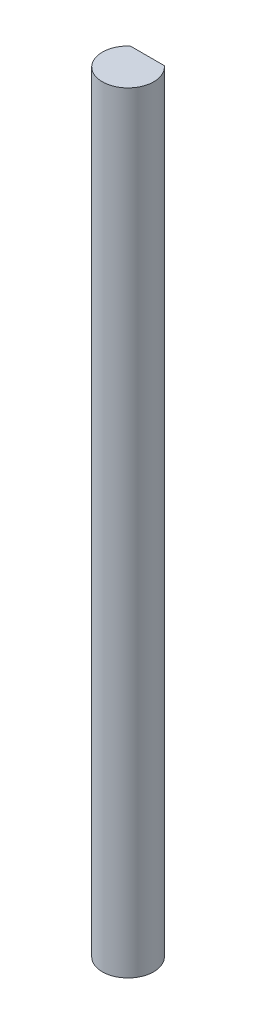
from build123d import *

# Parameters (mm, degrees)
SKETCH1_R          = 2
LENGTH_DEPTH       = 60
CUT_EXTRUDE1_DEPTH = 12


with BuildPart() as part:
    # Sketch1 → Length (new body)
    with BuildSketch(Plane(origin=(0, 0, 0), x_dir=(1, 0, 0), z_dir=(0, 1, 0))):
        Circle(SKETCH1_R)
    extrude(amount=LENGTH_DEPTH)

    # Sketch1<3> → Cut-Extrude1 (cut)
    with BuildSketch(Plane(origin=(0, 0, 0), x_dir=(1, 0, 0), z_dir=(0, 1, 0))):
        with BuildLine():
            ThreePointArc((1.322875656, 1.5), (0, 2), (-1.322875656, 1.5))
            Line((-1.322875656, 1.5), (1.322875656, 1.5))
        make_face()
    cut_extrude1 = extrude(amount=CUT_EXTRUDE1_DEPTH, mode=Mode.SUBTRACT)

    # Mirror1: Cut-Extrude1 across plane
    add(cut_extrude1.mirror(Plane(origin=(0, 30, 0), x_dir=(0, 0, 1), z_dir=(0, -1, 0))), mode=Mode.SUBTRACT)


solid = part.part
